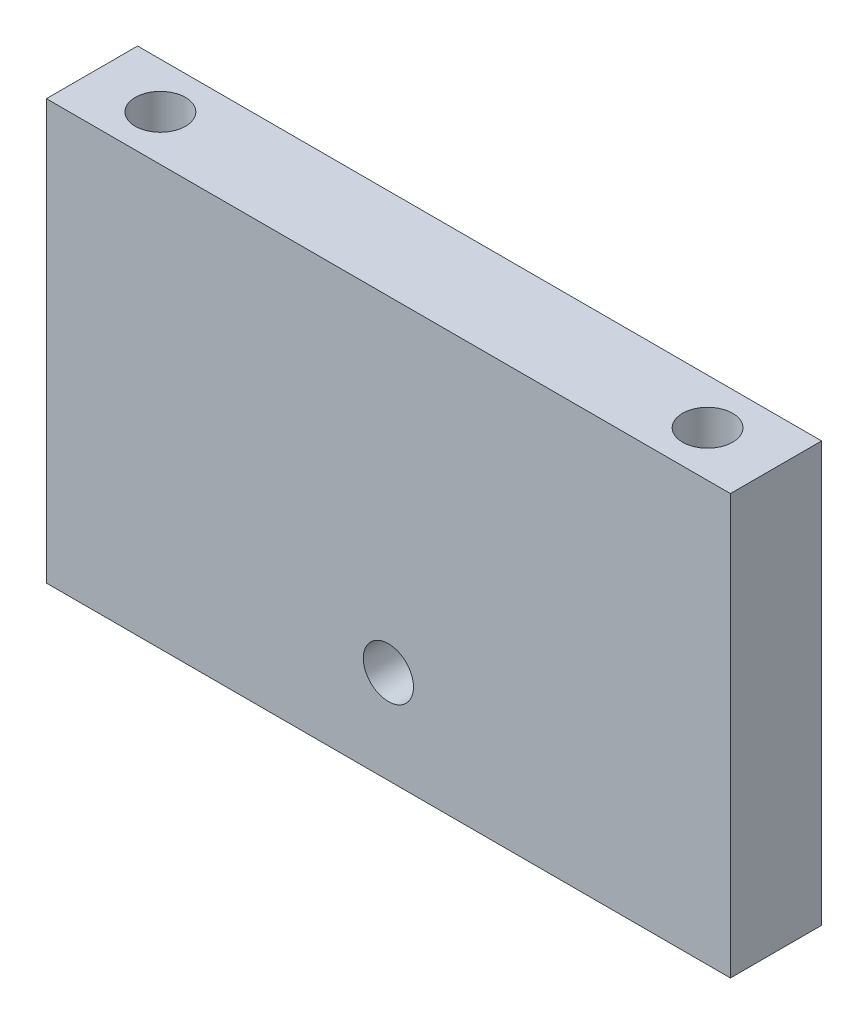
from build123d import *

# Parameters (mm, degrees)
SKETCH1_W           = 75
SKETCH1_H           = 10
SKETCH1_R           = 2.75
BOSS_EXTRUDE1_DEPTH = 46
SKETCH3_R           = 2.75
CUT_EXTRUDE1_DEPTH  = 45


with BuildPart() as part:
    # Sketch1 → Boss-Extrude1 (new body)
    with BuildSketch(Plane(origin=(0, 0, 0), x_dir=(1, 0, 0), z_dir=(0, 1, 0))):
        with Locations((37.5, 5)):
            Rectangle(SKETCH1_W, SKETCH1_H)
        with Locations(Location((7.5, 5, 0), (0, 0, 270))):
            Circle(SKETCH1_R, mode=Mode.SUBTRACT)
        with Locations(Location((67.5, 5, 0), (0, 0, 90))):
            Circle(SKETCH1_R, mode=Mode.SUBTRACT)
    extrude(amount=BOSS_EXTRUDE1_DEPTH)

    # Sketch3 → Cut-Extrude1 (cut)
    with BuildSketch(Plane.XY):
        with Locations((37.5, 10.25)):
            Circle(SKETCH3_R)
    extrude(amount=-CUT_EXTRUDE1_DEPTH, mode=Mode.SUBTRACT)


solid = part.part
